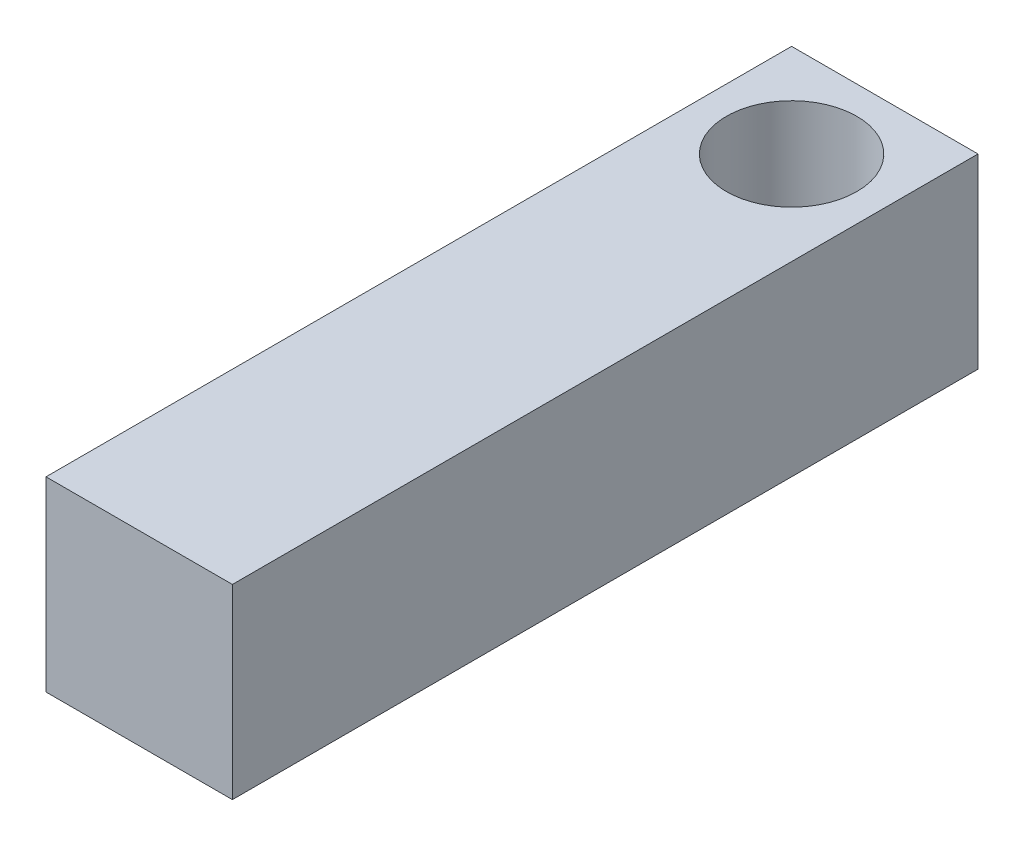
from build123d import *

# Parameters (mm, degrees)
SCHIZZO1_W                   = 5
SCHIZZO1_H                   = 5
ESTRUSIONE_ESTRUSIONE1_DEPTH = 20
SCHIZZO2_R                   = 1.75
TAGLIO_ESTRUSIONE1_DEPTH     = 22.213203436


with BuildPart() as part:
    # Schizzo1 → Estrusione-Estrusione1 (new body)
    with BuildSketch(Plane.XY):
        with Locations((-2.5, 2.5)):
            Rectangle(SCHIZZO1_W, SCHIZZO1_H)
    extrude(amount=ESTRUSIONE_ESTRUSIONE1_DEPTH)

    # Schizzo2 → Taglio-Estrusione1 (cut, through all)
    with BuildSketch(Plane(origin=(0, 0, 0), x_dir=(-1, 0, 0), z_dir=(0, -1, 0))):
        with Locations((2.5, -27.5)):
            Circle(SCHIZZO2_R)
        with Locations(Location((2.5, -2.5, 0), (0, 0, 180))):
            Circle(SCHIZZO2_R)
    extrude(amount=-TAGLIO_ESTRUSIONE1_DEPTH, mode=Mode.SUBTRACT)


solid = part.part
